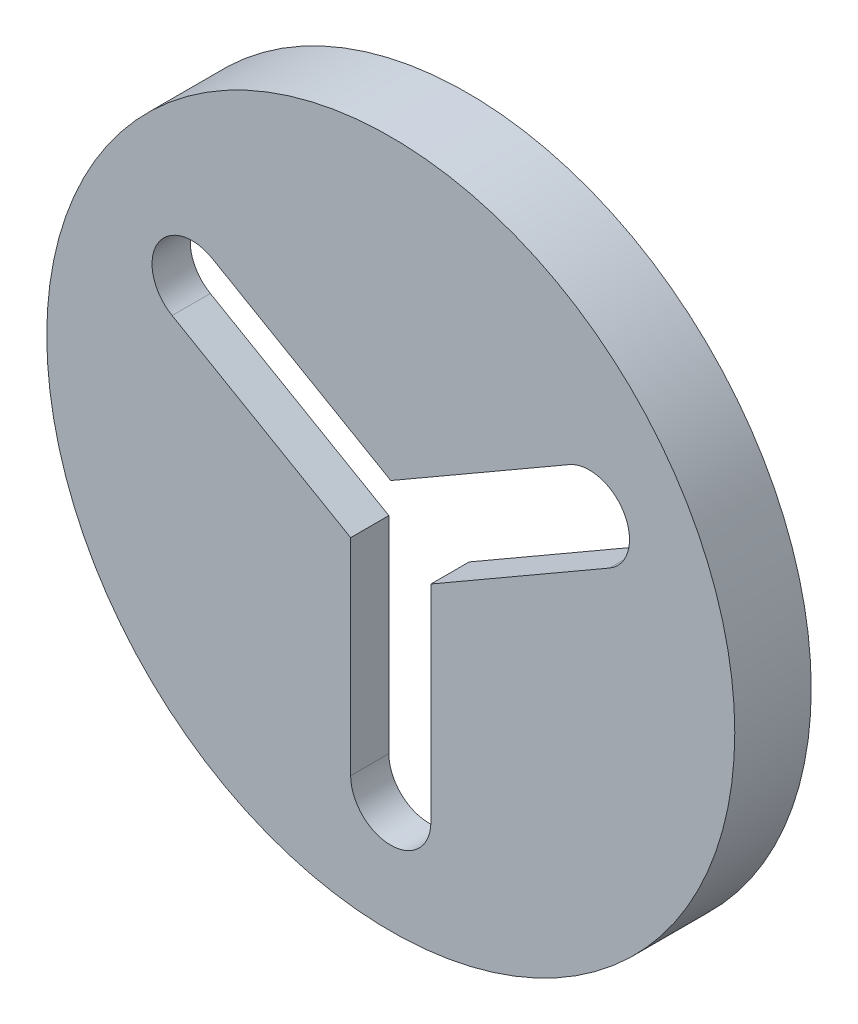
from build123d import *

# Parameters (mm, degrees)
CROQUIS1_R              = 40
DISCO_DEPTH             = 5
CORTAR_EXTRUIR1_DEPTH   = 10
SALIENTE_EXTRUIR5_START = -10
CROQUIS7_R              = 45
CROQUIS7_R_2            = 40
SALIENTE_EXTRUIR5_DEPTH = 10
CROQUIS8_R              = 41
CORTAR_EXTRUIR2_DEPTH   = 5


with BuildPart() as part:
    # Croquis1 → Disco (new body)
    with BuildSketch(Plane.XY):
        Circle(CROQUIS1_R)
    extrude(amount=DISCO_DEPTH)

    # Croquis6 → Cortar-Extruir1 (cut)
    with BuildSketch(Plane.XY.offset(5)):
        with BuildLine():
            Line((-5.25, 0), (-5.25, -30))
            ThreePointArc((-5.25, -30), (0, -35.25), (5.25, -30))
            Line((5.25, -30), (5.25, 0))
            ThreePointArc((5.25, 0), (0, 5.25), (-5.25, 0))
        make_face()
        with BuildLine():
            Line((2.625, 4.54663337), (-23.355762114, 19.54663337))
            ThreePointArc((-23.355762114, 19.54663337), (-30.527395483, 17.625), (-28.605762114, 10.45336663))
            Line((-28.605762114, 10.45336663), (-2.625, -4.54663337))
            ThreePointArc((-2.625, -4.54663337), (4.54663337, -2.625), (2.625, 4.54663337))
        make_face()
        with BuildLine():
            Line((2.625, -4.54663337), (28.605762114, 10.45336663))
            ThreePointArc((28.605762114, 10.45336663), (30.527395483, 17.625), (23.355762114, 19.54663337))
            Line((23.355762114, 19.54663337), (-2.625, 4.54663337))
            ThreePointArc((-2.625, 4.54663337), (-4.54663337, -2.625), (2.625, -4.54663337))
        make_face()
    extrude(amount=-CORTAR_EXTRUIR1_DEPTH, mode=Mode.SUBTRACT)

    # Croquis7 → Saliente-Extruir5 (add)
    with BuildSketch(Plane.XY.offset(5).offset(SALIENTE_EXTRUIR5_START)):
        Circle(CROQUIS7_R)
        Circle(CROQUIS7_R_2, mode=Mode.SUBTRACT)
    extrude(amount=SALIENTE_EXTRUIR5_DEPTH)

    # Croquis8 → Cortar-Extruir2 (cut)
    with BuildSketch(Plane(origin=(0, 0, -5), x_dir=(-1, 0, 0), z_dir=(0, 0, -1))):
        Circle(CROQUIS8_R)
    extrude(amount=-CORTAR_EXTRUIR2_DEPTH, mode=Mode.SUBTRACT)


solid = part.part
